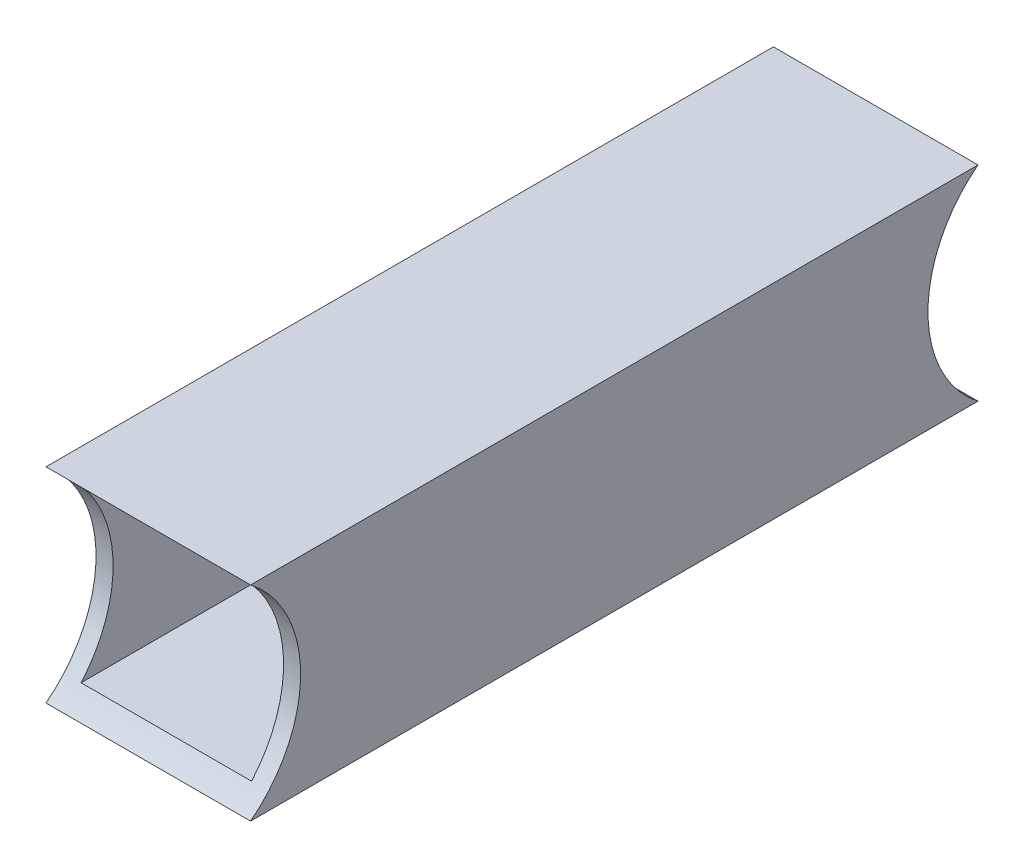
from build123d import *

# Parameters (mm, degrees)
BOSS_EXTRUDE1_DEPTH = 38.1
SKETCH2_W           = 31.75
SKETCH2_H           = 31.75
CUT_EXTRUDE1_DEPTH  = 160.656250733


with BuildPart() as part:
    # Sketch1 → Boss-Extrude1 (new body)
    with BuildSketch(Plane(origin=(0, 0, 0), x_dir=(0, 0, -1), z_dir=(1, 0, 0))):
        with BuildLine():
            ThreePointArc((24.13, 19.05), (21.675298243, 8.446305074), (14.810617813, 0))
            Line((14.810617813, 0), (150.289382187, 0))
            ThreePointArc((150.289382187, 0), (140.97, 19.05), (150.289382187, 38.1))
            Line((150.289382187, 38.1), (14.810617813, 38.1))
            ThreePointArc((14.810617813, 38.1), (21.675298243, 29.653694926), (24.13, 19.05))
        make_face()
    extrude(amount=BOSS_EXTRUDE1_DEPTH)

    # Sketch2 → Cut-Extrude1 (cut, through all)
    with BuildSketch(Plane.XY):
        with Locations((19.05, 19.05)):
            Rectangle(SKETCH2_W, SKETCH2_H)
    extrude(amount=-CUT_EXTRUDE1_DEPTH, mode=Mode.SUBTRACT)


solid = part.part
